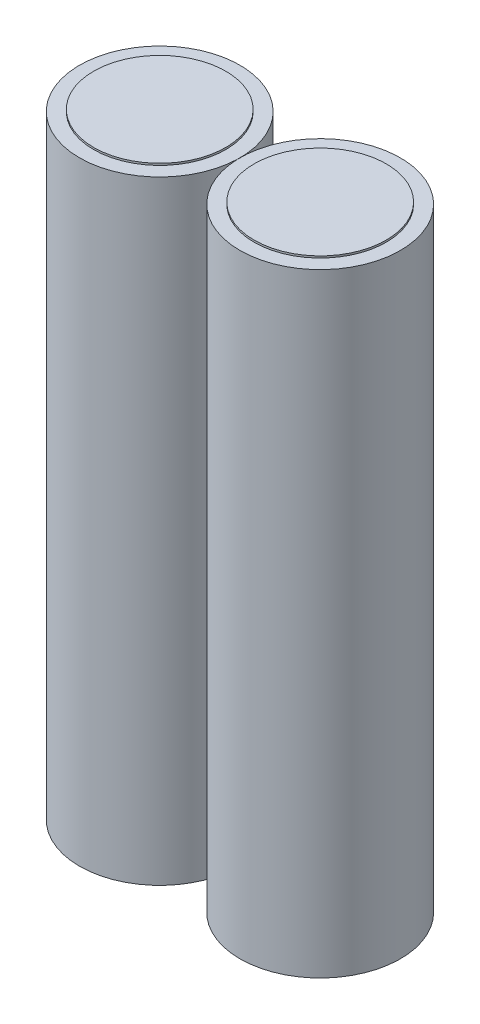
from build123d import *

# Parameters (mm, degrees)
SKETCH1_R             = 8.5
BOSS_EXTRUDE1_DEPTH   = 65
BOSS_EXTRUDE1_2_DEPTH = 65
SKETCH2_R             = 5
BOSS_EXTRUDE2_DEPTH   = 1
SKETCH3_R             = 7
BOSS_EXTRUDE3_DEPTH   = 0.2


with BuildPart() as part:
    # Sketch1 → Boss-Extrude1 (new body)
    with BuildSketch(Plane(origin=(0, 0, 0), x_dir=(1, 0, 0), z_dir=(0, 1, 0))):
        with Locations(Location((0, 0, 0), (0, 0, 270))):
            Circle(SKETCH1_R)
    extrude(amount=BOSS_EXTRUDE1_DEPTH)



with BuildPart() as body_2:
    # Sketch1 → Boss-Extrude1 2 (new body)
    with BuildSketch(Plane(origin=(0, 0, 0), x_dir=(1, 0, 0), z_dir=(0, 1, 0))):
        with Locations(Location((17, 0, 0), (0, 0, 270))):
            Circle(SKETCH1_R)
    extrude(amount=BOSS_EXTRUDE1_2_DEPTH)


with BuildPart() as part_1:
    add(part.part)

    add(body_2.part)  # Boss-Extrude2 merges body 2
    # Sketch2 → Boss-Extrude2 (add)
    with BuildSketch(Plane.XZ):
        with Locations(Location((17, 0, 0), (0, 0, 90))):
            Circle(SKETCH2_R)
        with Locations(Location((0, 0, 0), (0, 0, 90))):
            Circle(SKETCH2_R)
    extrude(amount=BOSS_EXTRUDE2_DEPTH)

    # Sketch3 → Boss-Extrude3 (add)
    with BuildSketch(Plane(origin=(0, 65, 0), x_dir=(1, 0, 0), z_dir=(0, 1, 0))):
        with Locations(Location((17, 0, 0), (0, 0, 270))):
            Circle(SKETCH3_R)
        with Locations(Location((0, 0, 0), (0, 0, 270))):
            Circle(SKETCH3_R)
    extrude(amount=BOSS_EXTRUDE3_DEPTH)


solid = part_1.part
